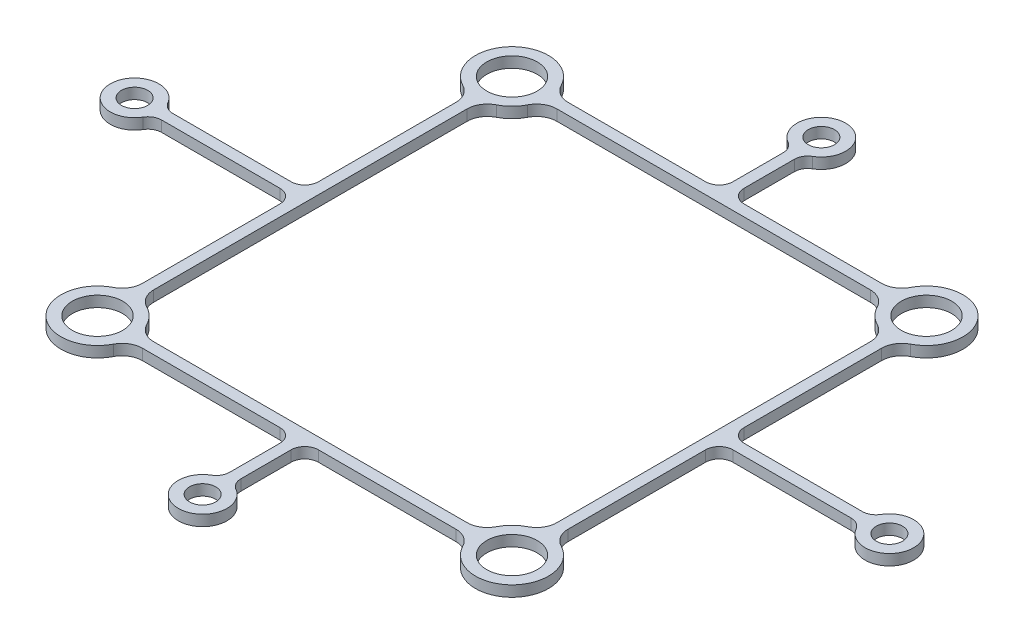
from build123d import *

# Parameters (mm, degrees)
SKETCH1_R           = 3.71
SKETCH1_R_2         = 1.925
BOSS_EXTRUDE1_DEPTH = 1.5875
FILLET1_R           = 3
FILLET2_R           = 2
FILLET3_R           = 2


with BuildPart() as part:
    # Sketch1 → Boss-Extrude1 (new body)
    with BuildSketch(Plane(origin=(0, 0, 0), x_dir=(1, 0, 0), z_dir=(0, 1, 0))):
        with BuildLine():
            Line((-25.148871697, 31.27), (-0.825, 31.27))
            Line((-0.825, 31.27), (-0.825, 41.966494574))
            ThreePointArc((-0.825, 41.966494574), (0, 49.02), (0.825, 41.966494574))
            Line((0.825, 41.966494574), (0.825, 31.27))
            Line((0.825, 31.27), (25.148871697, 31.27))
            ThreePointArc((25.148871697, 31.27), (34.235092347, 34.235092347), (31.27, 25.148871697))
            Line((31.27, 25.148871697), (31.27, 0.825))
            Line((31.27, 0.825), (51.966494574, 0.825))
            ThreePointArc((51.966494574, 0.825), (59.02, 0), (51.966494574, -0.825))
            Line((51.966494574, -0.825), (31.27, -0.825))
            Line((31.27, -0.825), (31.27, -25.148871697))
            ThreePointArc((31.27, -25.148871697), (34.235092347, -34.235092347), (25.148871697, -31.27))
            Line((25.148871697, -31.27), (0.825, -31.27))
            Line((0.825, -31.27), (0.825, -41.966494574))
            ThreePointArc((0.825, -41.966494574), (0, -49.02), (-0.825, -41.966494574))
            Line((-0.825, -41.966494574), (-0.825, -31.27))
            Line((-0.825, -31.27), (-25.148871697, -31.27))
            ThreePointArc((-25.148871697, -31.27), (-34.235092347, -34.235092347), (-31.27, -25.148871697))
            Line((-31.27, -25.148871697), (-31.27, -0.825))
            Line((-31.27, -0.825), (-51.966494574, -0.825))
            ThreePointArc((-51.966494574, -0.825), (-59.02, 0), (-51.966494574, 0.825))
            Line((-51.966494574, 0.825), (-31.27, 0.825))
            Line((-31.27, 0.825), (-31.27, 25.148871697))
            ThreePointArc((-31.27, 25.148871697), (-34.235092347, 34.235092347), (-25.148871697, 31.27))
        make_face()
        with Locations(Location((-30.445, 30.445, 0), (0, 0, 270))):
            Circle(SKETCH1_R, mode=Mode.SUBTRACT)
        with Locations(Location((30.445, 30.445, 0), (0, 0, 90))):
            Circle(SKETCH1_R, mode=Mode.SUBTRACT)
        with Locations(Location((30.445, -30.445, 0), (0, 0, 270))):
            Circle(SKETCH1_R, mode=Mode.SUBTRACT)
        with Locations(Location((-30.445, -30.445, 0), (0, 0, 90))):
            Circle(SKETCH1_R, mode=Mode.SUBTRACT)
        with Locations(Location((0, 45.445, 0), (0, 0, 270))):
            Circle(SKETCH1_R_2, mode=Mode.SUBTRACT)
        with Locations(Location((55.445, 0, 0), (0, 0, 270))):
            Circle(SKETCH1_R_2, mode=Mode.SUBTRACT)
        with Locations(Location((0, -45.445, 0), (0, 0, 90))):
            Circle(SKETCH1_R_2, mode=Mode.SUBTRACT)
        with Locations(Location((-55.445, 0, 0), (0, 0, 90))):
            Circle(SKETCH1_R_2, mode=Mode.SUBTRACT)
        with BuildLine():
            Line((-25.148871697, 29.62), (25.148871697, 29.62))
            ThreePointArc((25.148871697, 29.62), (26.654907653, 26.654907653), (29.62, 25.148871697))
            Line((29.62, 25.148871697), (29.62, -25.148871697))
            ThreePointArc((29.62, -25.148871697), (26.654907653, -26.654907653), (25.148871697, -29.62))
            Line((25.148871697, -29.62), (-25.148871697, -29.62))
            ThreePointArc((-25.148871697, -29.62), (-26.654907653, -26.654907653), (-29.62, -25.148871697))
            Line((-29.62, -25.148871697), (-29.62, 25.148871697))
            ThreePointArc((-29.62, 25.148871697), (-26.654907653, 26.654907653), (-25.148871697, 29.62))
        make_face(mode=Mode.SUBTRACT)
    extrude(amount=BOSS_EXTRUDE1_DEPTH)

    # Fillet1
    fillet1_edges = [part.edges().sort_by_distance(p)[0] for p in [
        (25.148871697, 0.79375, -31.27),
        (31.27, 0.79375, -25.148871697),
        (31.27, 0.79375, 25.148871697),
        (25.148871697, 0.79375, 31.27),
        (-25.148871697, 0.79375, 31.27),
        (-31.27, 0.79375, 25.148871697),
        (-31.27, 0.79375, -25.148871697),
        (-25.148871697, 0.79375, -31.27),
        (-25.148871697, 0.79375, -29.62),
        (-29.62, 0.79375, -25.148871697),
        (-29.62, 0.79375, 25.148871697),
        (-25.148871697, 0.79375, 29.62),
        (25.148871697, 0.79375, 29.62),
        (29.62, 0.79375, 25.148871697),
        (29.62, 0.79375, -25.148871697),
        (25.148871697, 0.79375, -29.62),
    ]]
    fillet(fillet1_edges, radius=FILLET1_R)

    # Fillet2
    fillet2_edges = [part.edges().sort_by_distance(p)[0] for p in [
        (0.825, 0.79375, -31.27),
        (31.27, 0.79375, -0.825),
        (31.27, 0.79375, 0.825),
        (0.825, 0.79375, 31.27),
        (-0.825, 0.79375, 31.27),
        (-31.27, 0.79375, 0.825),
        (-31.27, 0.79375, -0.825),
        (-0.825, 0.79375, -31.27),
    ]]
    fillet(fillet2_edges, radius=FILLET2_R)

    # Fillet3
    fillet3_edges = [part.edges().sort_by_distance(p)[0] for p in [
        (0.825, 0.79375, -41.966494574),
        (51.966494574, 0.79375, -0.825),
        (51.966494574, 0.79375, 0.825),
        (0.825, 0.79375, 41.966494574),
        (-0.825, 0.79375, 41.966494574),
        (-51.966494574, 0.79375, 0.825),
        (-51.966494574, 0.79375, -0.825),
        (-0.825, 0.79375, -41.966494574),
    ]]
    fillet(fillet3_edges, radius=FILLET3_R)


solid = part.part
